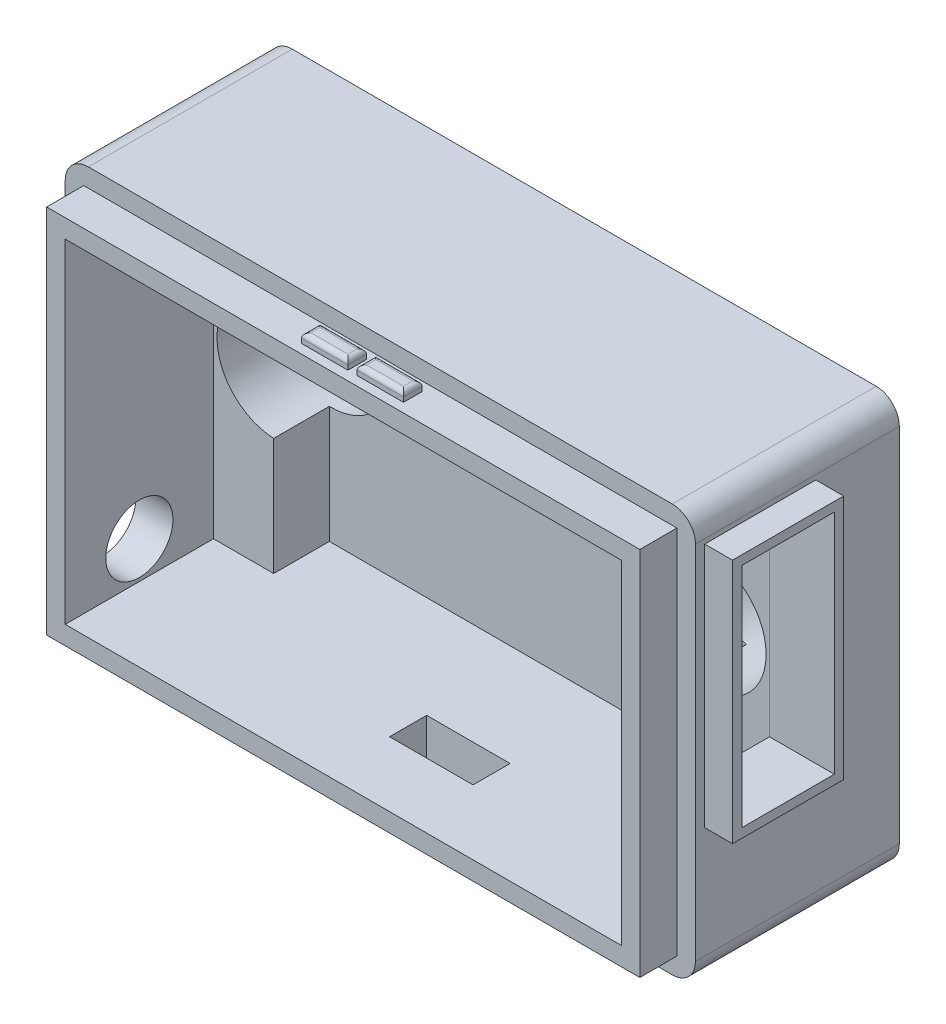
from build123d import *

# Parameters (mm, degrees)
SKETCH1_W                   = 68
SKETCH1_H                   = 44
MIAN_BOSS_EXTRUDE_DEPTH     = 26
SKETCH2_W                   = 60
SKETCH2_H                   = 36
MAIN_CUT_DEPTH              = 16
SKETCH4_W                   = 45
SKETCH4_H                   = 35
BATTERY_CUT_DEPTH           = 6
SKETCH5_R                   = 6.375
ELCTRODE_CUT_DEPTH          = 12
SKETCH6_W                   = 9.989337028
SKETCH6_H                   = 24.5
USB_C_CUT_DEPTH             = 7
SKETCH7_R                   = 3.625
BUTTON_CUT_DEPTH            = 7
SKETCH8_W                   = 9
SKETCH8_H                   = 4
SWITCH_CUT_DEPTH            = 7
OUTSIDE_FILLET_R            = 2.5
SKETCH10_OUTSIDE_W          = 87.012
SKETCH10_OUTSIDE_H          = 63.012
SKETCH10_OUTSIDE_W_2        = 64
SKETCH10_OUTSIDE_H_2        = 40
OUTER_LID_EXTRUDE_DEPTH     = 4
LID_SNAP_EXTRUDE_DEPTH      = 1
LID_SNAP_EXTRUDE_DEPTH_BACK = 41
SKETCH11_W                  = 5
SKETCH11_H                  = 2
SKETCH13_W                  = 11
SKETCH13_H                  = 36
INNER_LID_EXTRUDE_DEPTH     = 3
SKETCH14_W                  = 11.989337028
SKETCH14_H                  = 26.5
SKETCH14_W_2                = 9.989337028
SKETCH14_H_2                = 24.5
USB_COVER_EXTRUDE_DEPTH     = 3
LID_SNAP_FILLET_R           = 0.5


with BuildPart() as part:
    # Sketch1 → Mian Boss Extrude (new body)
    with BuildSketch(Plane.XY):
        with Locations((34, 22)):
            Rectangle(SKETCH1_W, SKETCH1_H)
    extrude(amount=MIAN_BOSS_EXTRUDE_DEPTH)

    # Sketch2 → Main cut (cut)
    with BuildSketch(Plane.XY.offset(26)):
        with Locations((34, 22)):
            Rectangle(SKETCH2_W, SKETCH2_H)
    extrude(amount=-MAIN_CUT_DEPTH, mode=Mode.SUBTRACT)

    # Sketch4 → Battery Cut (cut)
    with BuildSketch(Plane.XY.offset(10)):
        with Locations((33, 21.5)):
            Rectangle(SKETCH4_W, SKETCH4_H)
    extrude(amount=-BATTERY_CUT_DEPTH, mode=Mode.SUBTRACT)

    # Sketch5 → Elctrode Cut (cut)
    with BuildSketch(Plane(origin=(0, 0, 0), x_dir=(-1, 0, 0), z_dir=(0, 0, -1))):
        with Locations((-57.25, 23)):
            Circle(SKETCH5_R)
        with Locations((-10.75, 23)):
            Circle(SKETCH5_R)
    extrude(amount=-ELCTRODE_CUT_DEPTH, mode=Mode.SUBTRACT)

    # Sketch6 → USB-c Cut (cut)
    with BuildSketch(Plane(origin=(68, 0, 0), x_dir=(0, 0, -1), z_dir=(1, 0, 0))):
        with Locations((-15.005331486, 27.75)):
            Rectangle(SKETCH6_W, SKETCH6_H)
    extrude(amount=-USB_C_CUT_DEPTH, mode=Mode.SUBTRACT)

    # Sketch7 → Button Cut (cut)
    with BuildSketch(Plane.ZY):
        with Locations((18, 8)):
            Circle(SKETCH7_R)
    extrude(amount=-BUTTON_CUT_DEPTH, mode=Mode.SUBTRACT)

    # Sketch8 → Switch Cut (cut)
    with BuildSketch(Plane.XZ):
        with Locations((36.5, 17)):
            Rectangle(SKETCH8_W, SKETCH8_H)
    extrude(amount=-SWITCH_CUT_DEPTH, mode=Mode.SUBTRACT)

    # Outside Fillet
    outside_fillet_edges = [part.edges().sort_by_distance(p)[0] for p in [
        (0, 44, 13),
        (68, 44, 13),
        (68, 0, 13),
        (0, 0, 13),
    ]]
    fillet(outside_fillet_edges, radius=OUTSIDE_FILLET_R)

    # Sketch10 outside → Outer lid Extrude (cut)
    with BuildSketch(Plane.XY.offset(26)):
        with Locations((34, 22)):
            Rectangle(SKETCH10_OUTSIDE_W, SKETCH10_OUTSIDE_H)
        with Locations((34, 22)):
            Rectangle(SKETCH10_OUTSIDE_W_2, SKETCH10_OUTSIDE_H_2, mode=Mode.SUBTRACT)
    extrude(amount=-OUTER_LID_EXTRUDE_DEPTH, mode=Mode.SUBTRACT)

    # Sketch11 → Lid Snap-Extrude (add, two sides: drawn at the far end of the back side and taken through both)
    with BuildSketch(Plane.XZ.offset(-2).offset(-LID_SNAP_EXTRUDE_DEPTH_BACK)):
        with Locations((31, 24)):
            Rectangle(SKETCH11_W, SKETCH11_H)
        with Locations((37, 24)):
            Rectangle(SKETCH11_W, SKETCH11_H)
    extrude(amount=LID_SNAP_EXTRUDE_DEPTH + LID_SNAP_EXTRUDE_DEPTH_BACK)

    # Sketch13 → Inner Lid-Extrude (cut)
    with BuildSketch(Plane.XY.offset(25)):
        with Locations((34, 22)):
            Rectangle(SKETCH13_W, SKETCH13_H)
    extrude(amount=-INNER_LID_EXTRUDE_DEPTH, mode=Mode.SUBTRACT)

    # Sketch14 → USB Cover-Extrude (add)
    with BuildSketch(Plane(origin=(68, 0, 0), x_dir=(0, 0, -1), z_dir=(1, 0, 0))):
        with Locations((-15.005331486, 27.75)):
            Rectangle(SKETCH14_W, SKETCH14_H)
        with Locations((-15.005331486, 27.75)):
            Rectangle(SKETCH14_W_2, SKETCH14_H_2, mode=Mode.SUBTRACT)
    extrude(amount=USB_COVER_EXTRUDE_DEPTH)

    # Lid Snap Fillet
    lid_snap_fillet_edges = [part.edges().sort_by_distance(p)[0] for p in [
        (28.5, 43, 24),
        (31, 43, 25),
        (33.5, 43, 24),
        (31, 43, 23),
        (28.5, 1, 24),
        (31, 1, 23),
        (33.5, 1, 24),
        (31, 1, 25),
        (37, 43, 25),
        (39.5, 43, 24),
        (37, 43, 23),
        (34.5, 43, 24),
        (37, 1, 25),
        (34.5, 1, 24),
        (37, 1, 23),
        (39.5, 1, 24),
    ]]
    fillet(lid_snap_fillet_edges, radius=LID_SNAP_FILLET_R)


solid = part.part
